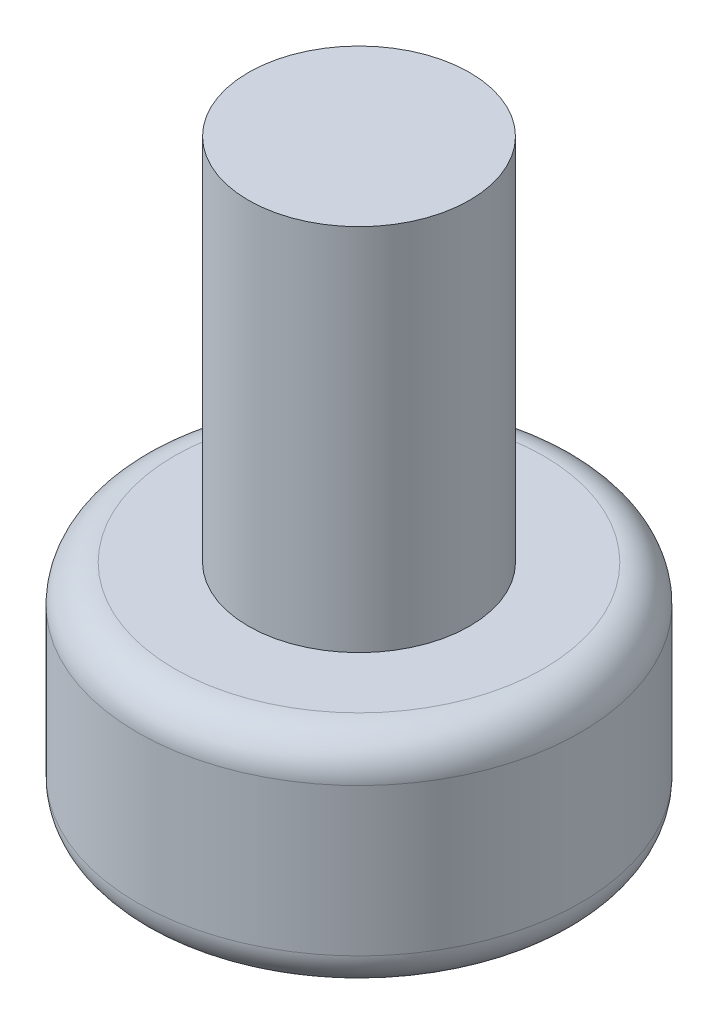
from build123d import *

# Parameters (mm, degrees)
IZIM1_R                     = 3
Y_KSEKLIK_EKSTR_ZYON1_DEPTH = 3
IZIM2_R                     = 1.5
Y_KSEKLIK_EKSTR_ZYON2_DEPTH = 5
RADYUS1_R                   = 0.5
KES_EKSTR_ZYON1_DEPTH       = 2


with BuildPart() as part:
    # Çizim1 → Yükseklik-Ekstrüzyon1 (new body)
    with BuildSketch(Plane(origin=(0, 0, 0), x_dir=(1, 0, 0), z_dir=(0, 1, 0))):
        with Locations(Location((0, 0, 0), (0, 0, 270))):
            Circle(IZIM1_R)
    extrude(amount=Y_KSEKLIK_EKSTR_ZYON1_DEPTH)

    # Çizim2 → Yükseklik-Ekstrüzyon2 (add)
    with BuildSketch(Plane(origin=(0, 3, 0), x_dir=(1, 0, 0), z_dir=(0, 1, 0))):
        with Locations(Location((0, 0, 0), (0, 0, 270))):
            Circle(IZIM2_R)
    extrude(amount=Y_KSEKLIK_EKSTR_ZYON2_DEPTH)

    # Radyus1
    radyus1_edges = [part.edges().sort_by_distance(p)[0] for p in [
        (0, 0, -3),
        (0, 3, -3),
    ]]
    fillet(radyus1_edges, radius=RADYUS1_R)

    # Çizim3 → Kes-Ekstrüzyon1 (cut)
    with BuildSketch(Plane.XZ):
        Polygon((1.732050808, 0), (0.866025404, 1.5), (-0.866025404, 1.5), (-1.732050808, 0), (-0.866025404, -1.5), (0.866025404, -1.5), align=None)
    extrude(amount=-KES_EKSTR_ZYON1_DEPTH, mode=Mode.SUBTRACT)


solid = part.part
